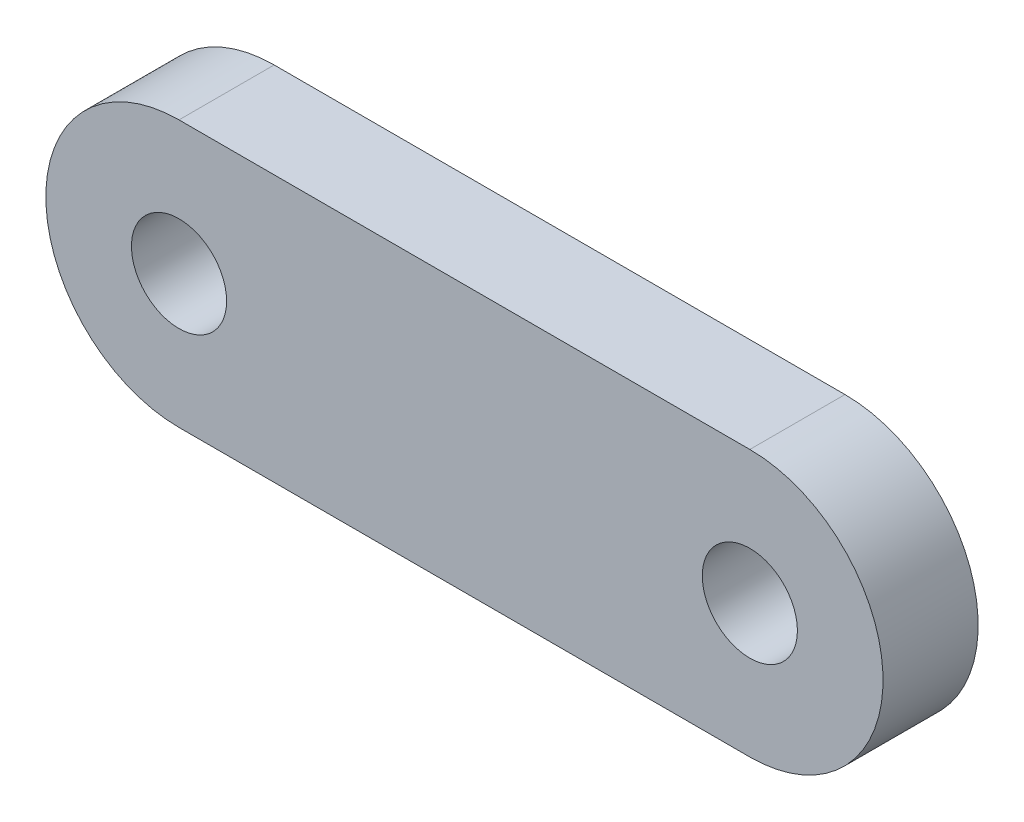
from build123d import *

# Parameters (mm, degrees)
SKETCH1_R           = 3.175
BOSS_EXTRUDE1_DEPTH = 6.35


with BuildPart() as part:
    # Sketch1 → Boss-Extrude1 (new body)
    with BuildSketch(Plane.XY):
        with BuildLine():
            Line((-19.05, -8.89), (19.05, -8.89))
            ThreePointArc((19.05, -8.89), (27.94, 0), (19.05, 8.89))
            Line((19.05, 8.89), (-19.05, 8.89))
            ThreePointArc((-19.05, 8.89), (-27.94, 0), (-19.05, -8.89))
        make_face()
        with Locations((-19.05, 0)):
            Circle(SKETCH1_R, mode=Mode.SUBTRACT)
        with Locations((19.05, 0)):
            Circle(SKETCH1_R, mode=Mode.SUBTRACT)
    extrude(amount=BOSS_EXTRUDE1_DEPTH)


solid = part.part
